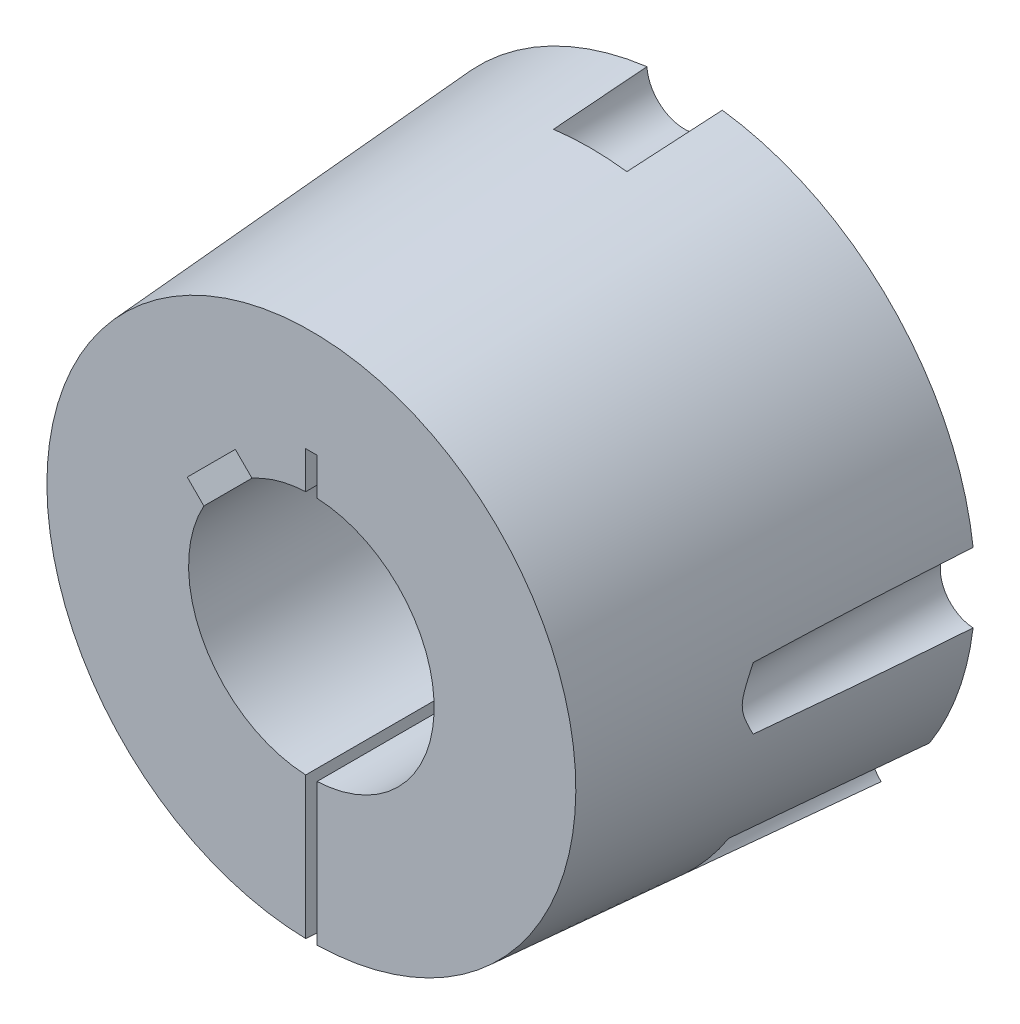
from build123d import *

# Parameters (mm, degrees)
CIRPATTERN1_COUNT       = 2
SKETCH7_R               = 10
CUT_EXTRUDE1_DEPTH      = 25
CIRPATTERN2_COUNT       = 2
CIRPATTERN2_ANGLE       = 130
SKETCH8_R               = 10
CUT_EXTRUDE2_DEPTH      = 50
CIRPATTERN3_COUNT       = 2
CIRPATTERN3_ANGLE       = 50
CUT_EXTRUDE3_DEPTH      = 1022.226122136
CUT_EXTRUDE3_DEPTH_BACK = 1022.226122136
SKETCH9_W               = 3
SKETCH9_H               = 87.216165293
CUT_EXTRUDE4_DEPTH      = 1022.226122136
CUT_EXTRUDE4_DEPTH_BACK = 1022.226122136
SKETCH12_R              = 10
CUT_EXTRUDE6_DEPTH      = 50
CUT_EXTRUDE7_DEPTH      = 1022.226122136
CUT_EXTRUDE7_DEPTH_BACK = 1022.226122136


with BuildPart() as part:
    # Sketch1 → Revolve1 (revolve)
    with BuildSketch(Plane(origin=(0, 0, 0), x_dir=(0, 0, -1), z_dir=(1, 0, 0)), mode=Mode.PRIVATE) as revolve1_sk:
        Polygon((627.254740219, 1014.21395543), (528.454740219, 1007.30518641), (528.454740219, 969.80518641), (532.567237031, 969.80518641), (611.238311694, 969.80518641), (627.254740219, 969.80518641), align=None)
    revolve(revolve1_sk.sketch.rotate(Axis((0, 937.30518641, -528.454740219), (0, 0, -1)), 90), axis=Axis((0, 937.30518641, -528.454740219), (0, 0, -1)))

    # Sketch6 → M20x1.5 Tapped Hole1 (revolve, cut)
    with BuildSketch(Plane(origin=(-76.90876902, 937.30518641, -627.254740219), x_dir=(0, 1, 0), z_dir=(1, 0, 0))):
        Polygon((0, 0), (0, 60.057960726), (9.25, 54.5), (9.25, 0), align=None)
    m20x1_5_tapped_hole1 = revolve(axis=Axis((-76.90876902, 937.30518641, -633.604740219), (0, 0, 1)), mode=Mode.SUBTRACT)

    # CirPattern1: M20x1.5 Tapped Hole1 ×2 about axis
    cirpattern1_axis = Axis((0, 937.30518641, 0), (0, 0, 1))
    for i in range(1, CIRPATTERN1_COUNT):
        add(m20x1_5_tapped_hole1.rotate(cirpattern1_axis, i * 360 / CIRPATTERN1_COUNT), mode=Mode.SUBTRACT)

    # Sketch7 → Cut-Extrude1 (cut)
    with BuildSketch(Plane(origin=(0, 0, -627.254740219), x_dir=(-1, 0, 0), z_dir=(0, 0, -1))):
        with Locations((0, 1014.21395543)):
            Circle(SKETCH7_R)
    cut_extrude1 = extrude(amount=-CUT_EXTRUDE1_DEPTH, mode=Mode.SUBTRACT)

    # CirPattern2: Cut-Extrude1 ×2 about axis
    cirpattern2_axis = Axis((0, 937.30518641, -627.254740219), (0, 0, -1))
    for i in range(1, CIRPATTERN2_COUNT):
        add(cut_extrude1.rotate(cirpattern2_axis, i * CIRPATTERN2_ANGLE / (CIRPATTERN2_COUNT - 1)), mode=Mode.SUBTRACT)

    # Sketch8 → Cut-Extrude2 (cut)
    with BuildSketch(Plane(origin=(0, 0, -627.254740219), x_dir=(-1, 0, 0), z_dir=(0, 0, -1))):
        with Locations((0, 860.39641739)):
            Circle(SKETCH8_R)
    cut_extrude2 = extrude(amount=-CUT_EXTRUDE2_DEPTH, mode=Mode.SUBTRACT)

    # CirPattern3: Cut-Extrude2 ×2 about axis
    cirpattern3_axis = Axis((0, 937.30518641, -627.254740219), (0, 0, -1))
    for i in range(1, CIRPATTERN3_COUNT):
        add(cut_extrude2.rotate(cirpattern3_axis, i * CIRPATTERN3_ANGLE / (CIRPATTERN3_COUNT - 1)), mode=Mode.SUBTRACT)

    # Sketch9 → Cut-Extrude3 (cut, two sides: drawn at the far end of the back side and taken through both)
    with BuildSketch(Plane(origin=(0, 0, -627.254740219), x_dir=(-1, 0, 0), z_dir=(0, 0, -1)).offset(-CUT_EXTRUDE3_DEPTH_BACK)):
        with Locations((0, 893.697103764)):
            Rectangle(SKETCH9_W, SKETCH9_H)
    extrude(amount=CUT_EXTRUDE3_DEPTH + CUT_EXTRUDE3_DEPTH_BACK, mode=Mode.SUBTRACT)

    # Sketch10 → Cut-Extrude4 (cut, two sides: drawn at the far end of the back side and taken through both)
    with BuildSketch(Plane(origin=(0, 0, -627.254740219), x_dir=(-1, 0, 0), z_dir=(0, 0, -1)).offset(-CUT_EXTRUDE4_DEPTH_BACK)):
        Polygon((1.5, 957.30518641), (1.5, 979.639325832), (-1.5, 979.639325832), (-1.5, 957.30518641), (-1.5, 953.730478501), (1.5, 953.730478501), align=None)
    extrude(amount=CUT_EXTRUDE4_DEPTH + CUT_EXTRUDE4_DEPTH_BACK, mode=Mode.SUBTRACT)

    # Sketch12 → Cut-Extrude6 (cut)
    with BuildSketch(Plane(origin=(0, 0, -627.254740219), x_dir=(-1, 0, 0), z_dir=(0, 0, -1))):
        with Locations((-58.915535135, 887.869182608)):
            Circle(SKETCH12_R)
    extrude(amount=-CUT_EXTRUDE6_DEPTH, mode=Mode.SUBTRACT)

    # Sketch13 → Cut-Extrude7 (cut, two sides: drawn at the far end of the back side and taken through both)
    with BuildSketch(Plane(origin=(0, 0, -627.254740219), x_dir=(-1, 0, 0), z_dir=(0, 0, -1)).offset(-CUT_EXTRUDE7_DEPTH_BACK)):
        Polygon((13.05698563, 963.090094101), (25.784907691, 950.36217204), (32.855975503, 957.433239852), (20.128053442, 970.161161913), align=None)
    extrude(amount=CUT_EXTRUDE7_DEPTH + CUT_EXTRUDE7_DEPTH_BACK, mode=Mode.SUBTRACT)


solid = part.part
